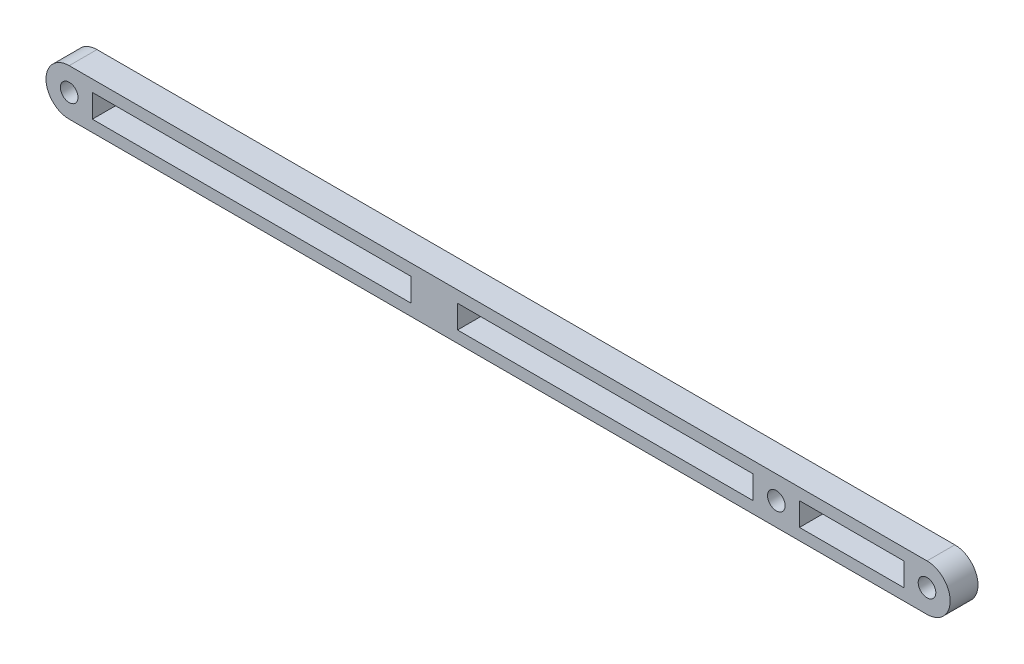
from build123d import *

# Parameters (mm, degrees)
SKETCH1_R           = 1.9
BOSS_EXTRUDE1_DEPTH = 6
SKETCH2_W           = 142.5
SKETCH2_H           = 5
SKETCH2_W_2         = 22.5
CUT_EXTRUDE1_DEPTH  = 98.812320287
SKETCH3_W           = 10
SKETCH3_H           = 5
BOSS_EXTRUDE2_DEPTH = 6


with BuildPart() as part:
    # Sketch1 → Boss-Extrude1 (new body)
    with BuildSketch(Plane.XY):
        with BuildLine():
            Line((-92.5, 5), (92.5, 5))
            ThreePointArc((92.5, 5), (97.5, 0), (92.5, -5))
            Line((92.5, -5), (-92.5, -5))
            ThreePointArc((-92.5, -5), (-97.5, 0), (-92.5, 5))
        make_face()
        with Locations((-92.5, 0)):
            Circle(SKETCH1_R, mode=Mode.SUBTRACT)
        with Locations((92.5, 0)):
            Circle(SKETCH1_R, mode=Mode.SUBTRACT)
        with Locations((60, 0)):
            Circle(SKETCH1_R, mode=Mode.SUBTRACT)
    extrude(amount=BOSS_EXTRUDE1_DEPTH)

    # Sketch2 → Cut-Extrude1 (cut, through all)
    with BuildSketch(Plane.XY.offset(6)):
        with Locations((-16.25, 0)):
            Rectangle(SKETCH2_W, SKETCH2_H)
        with Locations((76.25, 0)):
            Rectangle(SKETCH2_W_2, SKETCH2_H)
    extrude(amount=-CUT_EXTRUDE1_DEPTH, mode=Mode.SUBTRACT)

    # Sketch3 → Boss-Extrude2 (add, through all)
    with BuildSketch(Plane.XY.offset(6)):
        with Locations((-13.75, 0)):
            Rectangle(SKETCH3_W, SKETCH3_H)
    extrude(amount=-BOSS_EXTRUDE2_DEPTH)


solid = part.part
